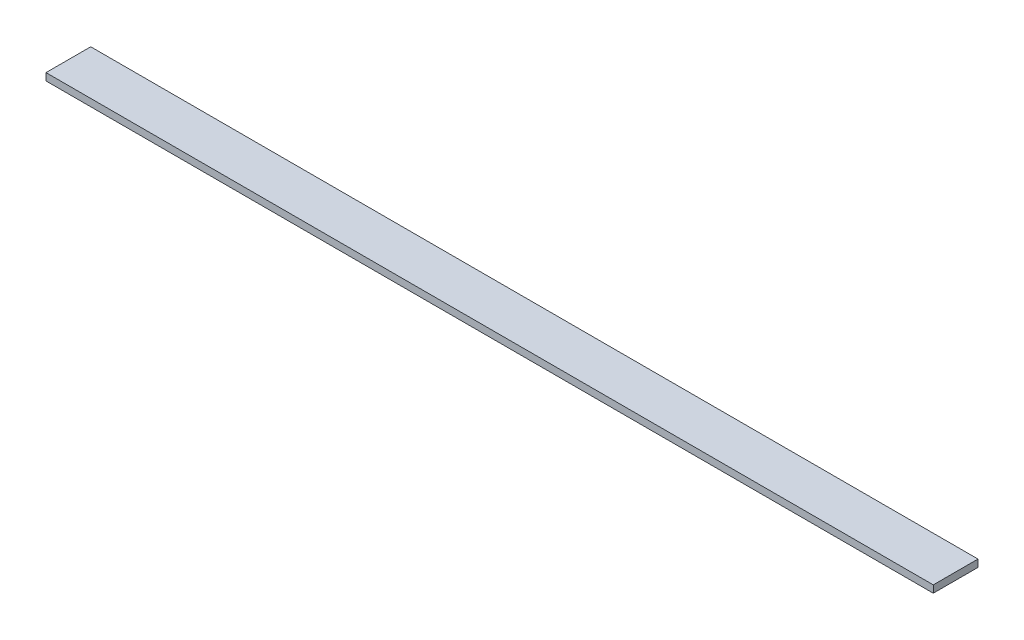
from build123d import *

# Parameters (mm, degrees)
SKETCH1_W           = 4660.9
SKETCH1_H           = 234.95
BOSS_EXTRUDE1_DEPTH = 38.1


with BuildPart() as part:
    # Sketch1 → Boss-Extrude1 (new body)
    with BuildSketch(Plane(origin=(0, 0, 0), x_dir=(1, 0, 0), z_dir=(0, 1, 0))):
        with Locations((1887.721088435, 33.564285714)):
            Rectangle(SKETCH1_W, SKETCH1_H)
    extrude(amount=BOSS_EXTRUDE1_DEPTH)


solid = part.part
